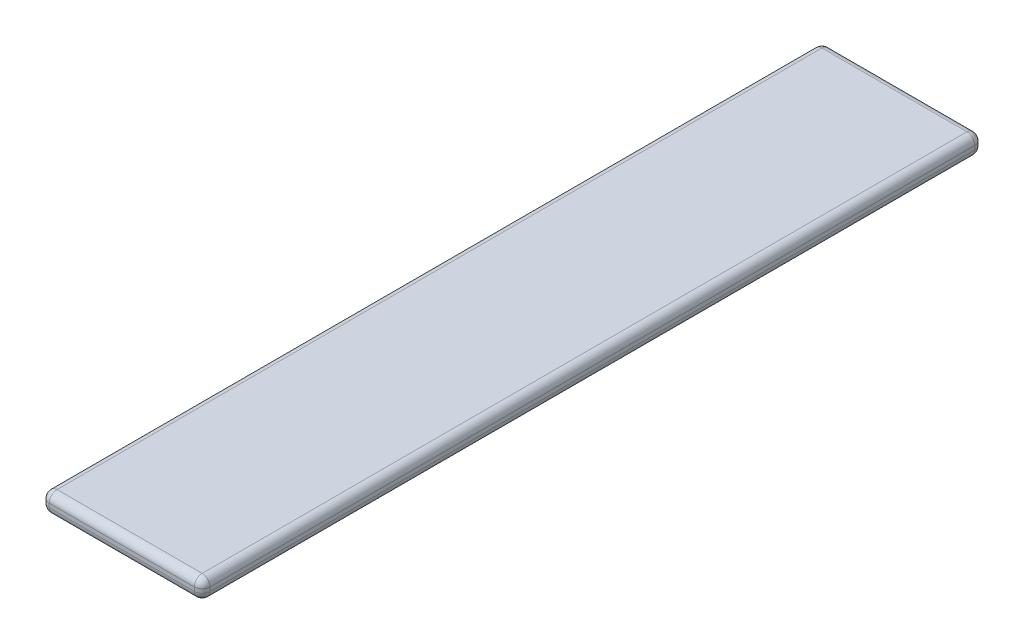
from build123d import *

# Parameters (mm, degrees)
SKETCH1_W           = 410
SKETCH1_H           = 50
BOSS_EXTRUDE1_DEPTH = 1990
FILLET1_R           = 20


with BuildPart() as part:
    # Sketch1 → Boss-Extrude1 (new body)
    with BuildSketch(Plane.XY):
        Rectangle(SKETCH1_W, SKETCH1_H)
    extrude(amount=BOSS_EXTRUDE1_DEPTH)

    # Fillet1
    fillet1_edges = [part.edges().sort_by_distance(p)[0] for p in [
        (205, 0, 1990),
        (0, 25, 1990),
        (-205, 0, 1990),
        (0, 25, 0),
        (205, 0, 0),
        (0, -25, 0),
        (-205, 0, 0),
        (0, -25, 1990),
        (-205, 25, 995),
        (205, 25, 995),
        (205, -25, 995),
        (-205, -25, 995),
    ]]
    fillet(fillet1_edges, radius=FILLET1_R)


solid = part.part
